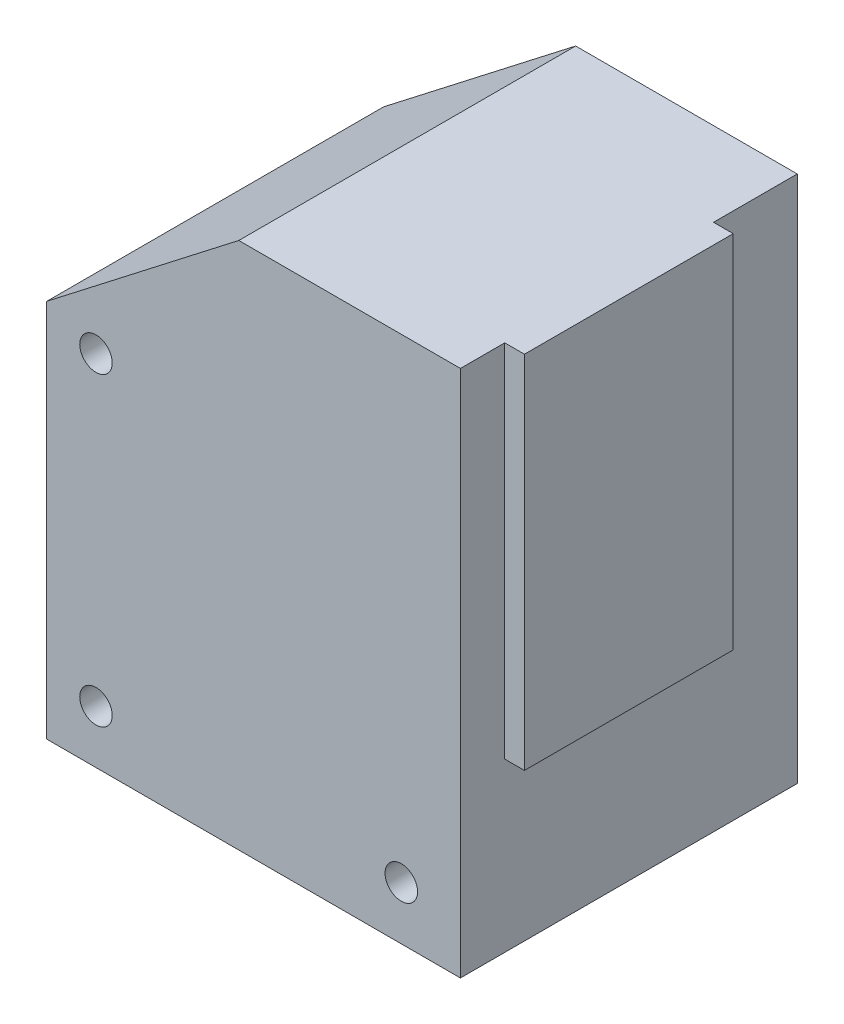
from build123d import *

# Parameters (mm, degrees)
BOSS_EXTRUDE1_DEPTH = 34.2
SKETCH2_R           = 8
CUT_EXTRUDE1_DEPTH  = 10
SKETCH3_W           = 21.2
SKETCH3_H           = 36.6
BOSS_EXTRUDE2_DEPTH = 2
SKETCH5_R           = 1.65
CUT_EXTRUDE4_DEPTH  = 78.321407126


with BuildPart() as part:
    # Sketch1 → Boss-Extrude1 (new body)
    with BuildSketch(Plane.XY):
        Polygon((0, 38.5), (19.5, 53.6), (42, 53.6), (42, 0), (0, 0), align=None)
    extrude(amount=BOSS_EXTRUDE1_DEPTH)

    # Sketch2 → Cut-Extrude1 (cut)
    with BuildSketch(Plane.XZ):
        with Locations(Location((26, 23.7, 0), (0, 0, 270))):
            Circle(SKETCH2_R)
    extrude(amount=-CUT_EXTRUDE1_DEPTH, mode=Mode.SUBTRACT)

    # Sketch3 → Boss-Extrude2 (add)
    with BuildSketch(Plane(origin=(42, 0, 0), x_dir=(0, 0, -1), z_dir=(1, 0, 0))):
        with Locations((-19.1, 35.3)):
            Rectangle(SKETCH3_W, SKETCH3_H)
    extrude(amount=BOSS_EXTRUDE2_DEPTH)

    # Sketch5 → Cut-Extrude4 (cut, through all)
    with BuildSketch(Plane(origin=(0, 0, 0), x_dir=(-1, 0, 0), z_dir=(0, 0, -1))):
        with Locations((-36, 5.4)):
            Circle(SKETCH5_R)
        with Locations((-5, 5.4)):
            Circle(SKETCH5_R)
        with Locations((-5, 36.4)):
            Circle(SKETCH5_R)
    extrude(amount=-CUT_EXTRUDE4_DEPTH, mode=Mode.SUBTRACT)


solid = part.part
